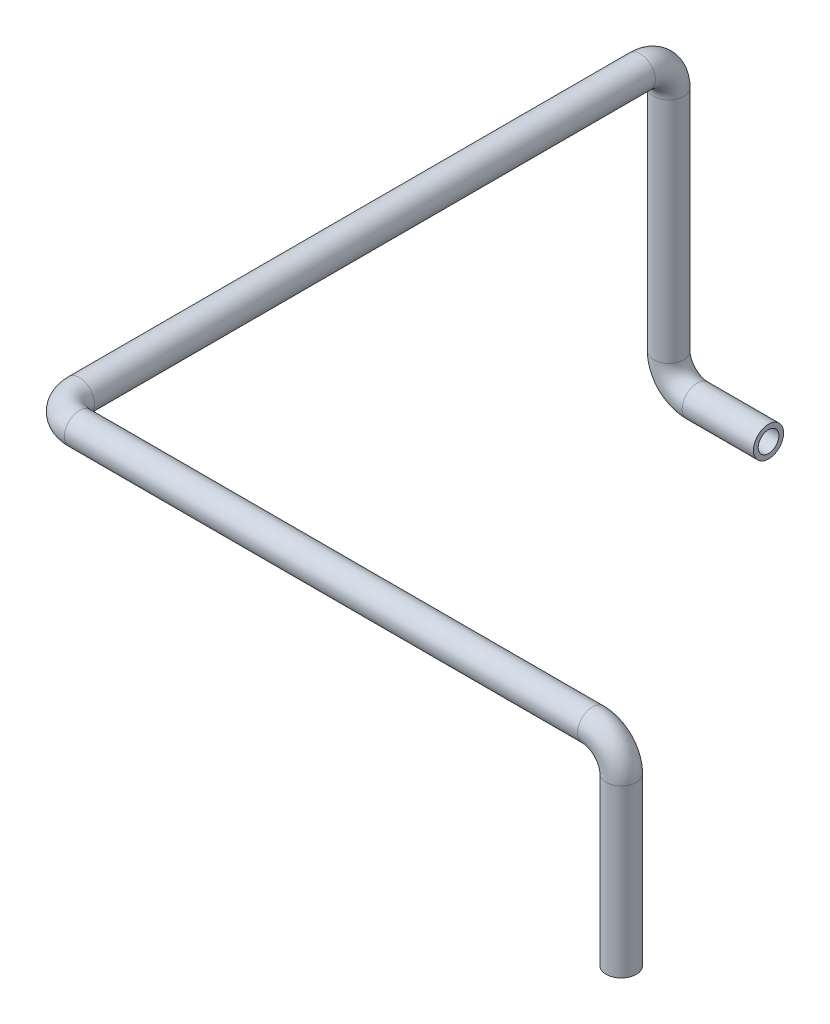
from build123d import *

# Parameters (mm, degrees)
TUBE_PROFILE_R   = 3.175
TUBE_PROFILE_R_2 = 2.175


with BuildPart() as part:
    # Tube: sweep along a curve in space
    with BuildLine() as tube_path:
        Line((-149, 290, 50), (-164, 290, 50))
        ThreePointArc((-170, 296, 50), (-168.242640687, 291.757359313, 50), (-164, 290, 50))
        Line((-170, 296, 50), (-170, 344, 50))
        ThreePointArc((-170, 350, 56), (-170, 348.242640687, 51.757359313), (-170, 344, 50))
        Line((-170, 350, 56), (-170, 350, 174))
        ThreePointArc((-164, 350, 180), (-168.242640687, 350, 178.242640687), (-170, 350, 174))
        Line((-164, 350, 180), (-56, 350, 180))
        ThreePointArc((-50, 344, 180), (-51.757359313, 348.242640687, 180), (-56, 350, 180))
        Line((-50, 344, 180), (-50, 309, 180))
    # Tube profile (on start of the path) → Tube (sweep)
    with BuildSketch(Plane(origin=(-149, 290, 50), x_dir=(0, 0, -1), z_dir=(-1, 0, 0))):
        Circle(TUBE_PROFILE_R)
        Circle(TUBE_PROFILE_R_2, mode=Mode.SUBTRACT)
    sweep(path=tube_path.line)


solid = part.part
